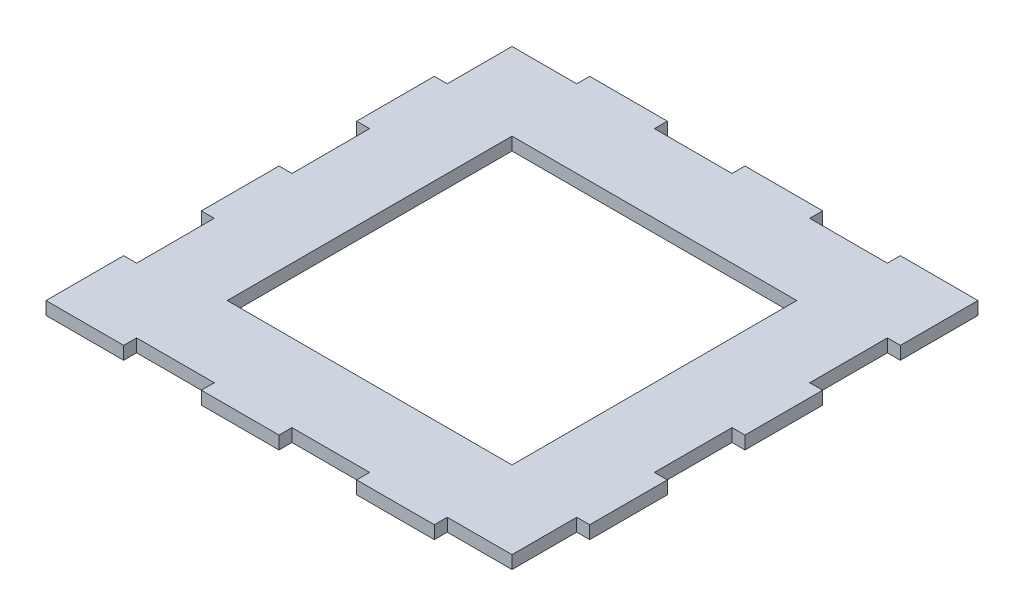
from build123d import *

# Parameters (mm, degrees)
SKETCH1_W           = 457.2
SKETCH1_H           = 457.2
BOSS_EXTRUDE1_DEPTH = 12.7
SKETCH2_W           = 279.4
SKETCH2_H           = 279.4
CUT_EXTRUDE1_DEPTH  = 324.538575753
SKETCH3_W           = 12.7
SKETCH3_H           = 12.7
SKETCH3_W_2         = 63.5
SKETCH3_H_2         = 63.5
SKETCH3_W_3         = 76.2
SKETCH3_H_3         = 76.2
CUT_EXTRUDE2_DEPTH  = 324.538575753


with BuildPart() as part:
    # Sketch1 → Boss-Extrude1 (new body)
    with BuildSketch(Plane(origin=(0, 0, 0), x_dir=(1, 0, 0), z_dir=(0, 1, 0))):
        Rectangle(SKETCH1_W, SKETCH1_H)
    extrude(amount=BOSS_EXTRUDE1_DEPTH)

    # Sketch2 → Cut-Extrude1 (cut, through all)
    with BuildSketch(Plane(origin=(0, 12.7, 0), x_dir=(1, 0, 0), z_dir=(0, 1, 0))):
        Rectangle(SKETCH2_W, SKETCH2_H)
    extrude(amount=-CUT_EXTRUDE1_DEPTH, mode=Mode.SUBTRACT)

    # Sketch3 → Cut-Extrude2 (cut, through all)
    with BuildSketch(Plane(origin=(0, 12.7, 0), x_dir=(1, 0, 0), z_dir=(0, 1, 0))):
        with Locations((-222.25, 222.25)):
            Rectangle(SKETCH3_W, SKETCH3_H)
        with Locations((-184.15, 222.25)):
            Rectangle(SKETCH3_W_2, SKETCH3_H)
        with Locations((-222.25, 184.15)):
            Rectangle(SKETCH3_W, SKETCH3_H_2)
        with Locations((-38.1, 222.25)):
            Rectangle(SKETCH3_W_3, SKETCH3_H)
        with Locations((114.3, 222.25)):
            Rectangle(SKETCH3_W_3, SKETCH3_H)
        with Locations((222.25, -222.25)):
            Rectangle(SKETCH3_W, SKETCH3_H)
        with Locations((184.15, -222.25)):
            Rectangle(SKETCH3_W_2, SKETCH3_H)
        with Locations((222.25, -184.15)):
            Rectangle(SKETCH3_W, SKETCH3_H_2)
        with Locations((222.25, -38.1)):
            Rectangle(SKETCH3_W, SKETCH3_H_3)
        with Locations((222.25, 114.3)):
            Rectangle(SKETCH3_W, SKETCH3_H_3)
        with Locations((38.1, -222.25)):
            Rectangle(SKETCH3_W_3, SKETCH3_H)
        with Locations((-114.3, -222.25)):
            Rectangle(SKETCH3_W_3, SKETCH3_H)
        with Locations((-222.25, 38.1)):
            Rectangle(SKETCH3_W, SKETCH3_H_3)
        with Locations((-222.25, -114.3)):
            Rectangle(SKETCH3_W, SKETCH3_H_3)
    extrude(amount=-CUT_EXTRUDE2_DEPTH, mode=Mode.SUBTRACT)


solid = part.part
